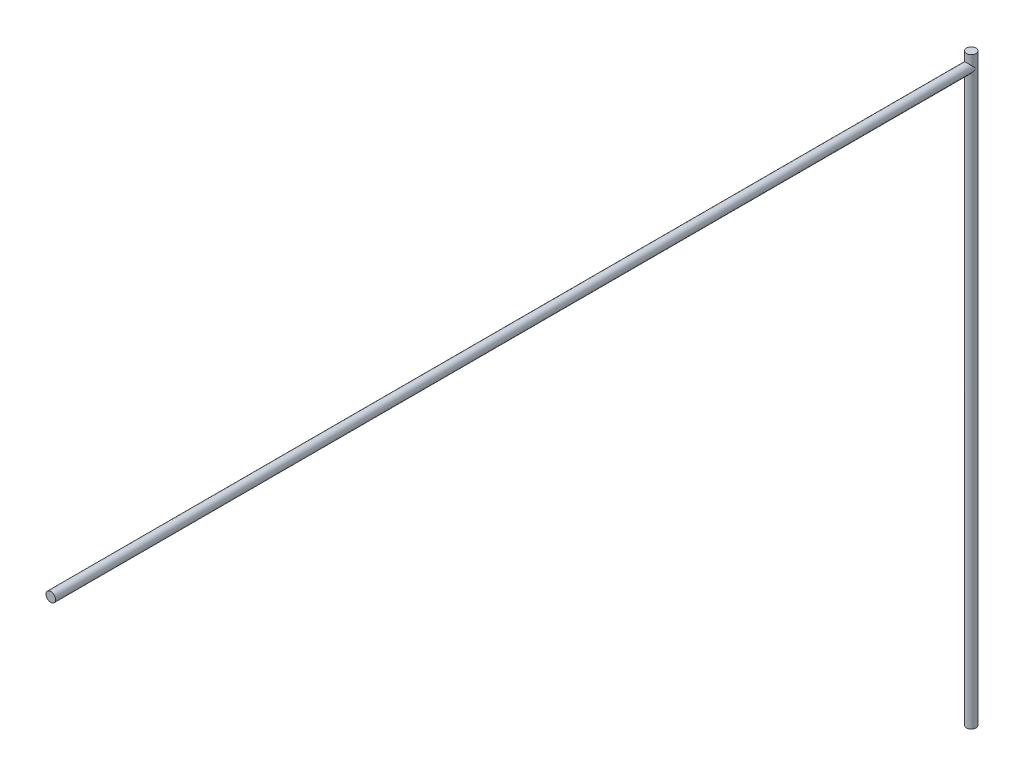
from build123d import *

# Parameters (mm, degrees)
SKETCH_1_R           = 0.75
EXTRUDE_1_DEPTH      = 145
EXTRUDE_2_DEPTH      = 2
EXTRUDE_2_DEPTH_BACK = 90
SKETCH_2_R           = 0.75


with BuildPart() as part:
    # 草图1 → 凸台-拉伸1 (new body)
    with BuildSketch(Plane.XY):
        Circle(SKETCH_1_R)
    extrude(amount=EXTRUDE_1_DEPTH)

    # 草图2 → 凸台-拉伸2 (add, two sides: drawn at the far end of the back side and taken through both)
    with BuildSketch(Plane(origin=(0, 0, 0), x_dir=(1, 0, 0), z_dir=(0, 1, 0)).offset(-EXTRUDE_2_DEPTH_BACK)):
        with Locations(Location((0, 0, 0), (0, 0, 270))):
            Circle(SKETCH_2_R)
    extrude(amount=EXTRUDE_2_DEPTH + EXTRUDE_2_DEPTH_BACK)


solid = part.part
